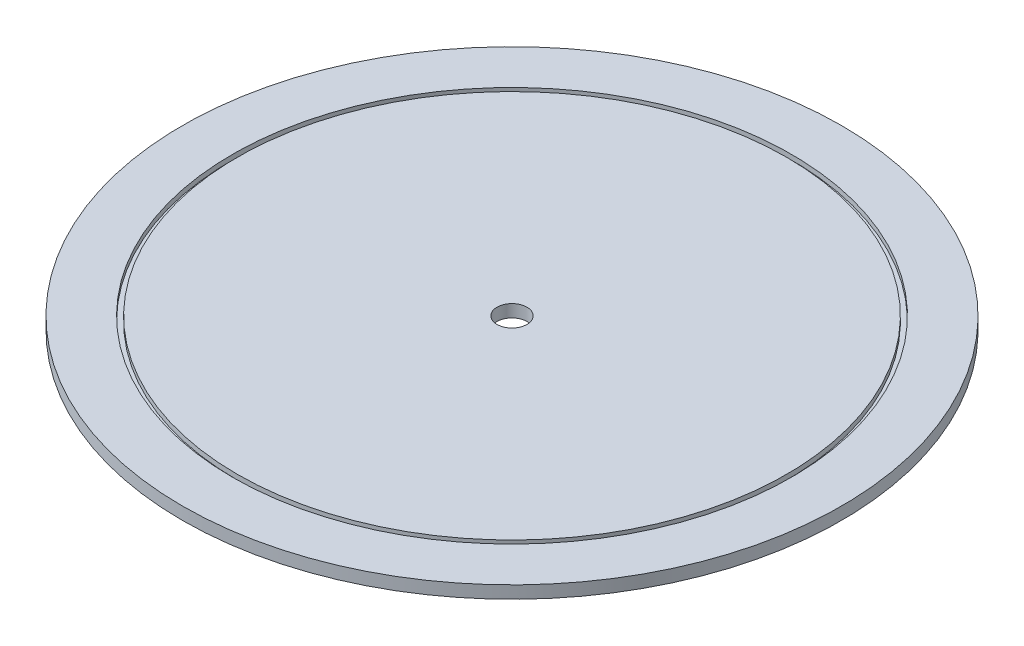
from build123d import *

# Parameters (mm, degrees)
SKETCH1_R           = 132
BOSS_EXTRUDE1_DEPTH = 5
SKETCH2_R           = 112
SKETCH2_R_2         = 110
CUT_EXTRUDE1_DEPTH  = 2
SKETCH3_R           = 6
CUT_EXTRUDE2_DEPTH  = 22


with BuildPart() as part:
    # Sketch1 → Boss-Extrude1 (new body)
    with BuildSketch(Plane(origin=(0, 0, 0), x_dir=(1, 0, 0), z_dir=(0, 1, 0))):
        with Locations(Location((0, 0, 0), (0, 0, 270))):
            Circle(SKETCH1_R)
    extrude(amount=BOSS_EXTRUDE1_DEPTH)

    # Sketch2 → Cut-Extrude1 (cut)
    with BuildSketch(Plane(origin=(0, 5, 0), x_dir=(1, 0, 0), z_dir=(0, 1, 0))):
        with Locations(Location((0, 0, 0), (0, 0, 270))):
            Circle(SKETCH2_R)
        with Locations(Location((0, 0, 0), (0, 0, 270))):
            Circle(SKETCH2_R_2, mode=Mode.SUBTRACT)
    extrude(amount=-CUT_EXTRUDE1_DEPTH, mode=Mode.SUBTRACT)

    # Sketch3 → Cut-Extrude2 (cut)
    with BuildSketch(Plane(origin=(0, 5, 0), x_dir=(1, 0, 0), z_dir=(0, 1, 0))):
        with Locations(Location((0, 0, 0), (0, 0, 270))):
            Circle(SKETCH3_R)
    extrude(amount=-CUT_EXTRUDE2_DEPTH, mode=Mode.SUBTRACT)


solid = part.part
